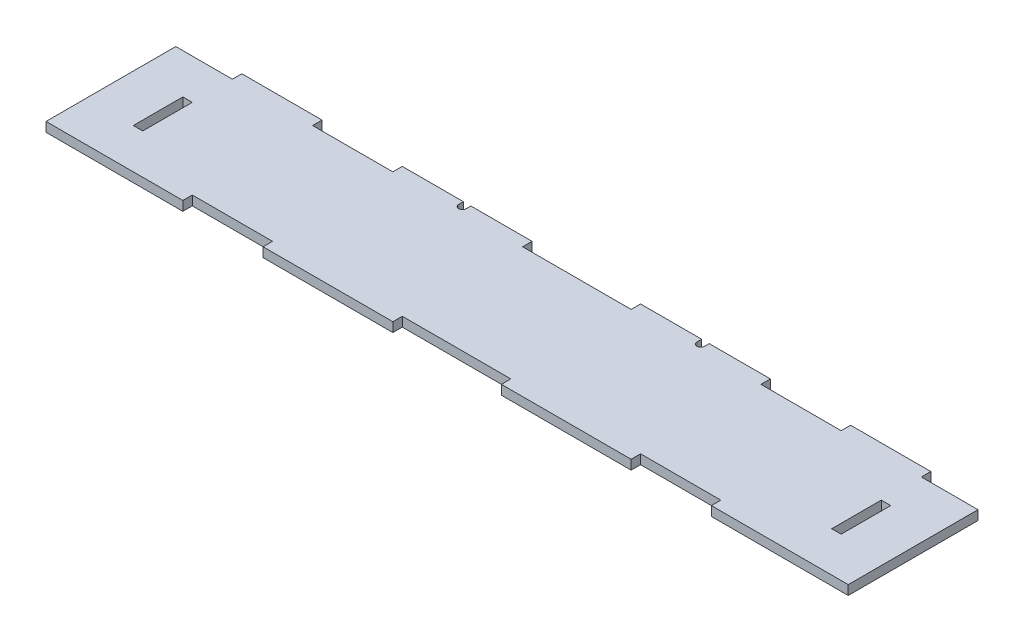
from build123d import *

# Parameters (mm, degrees)
SKETCH1_W           = 4
SKETCH1_H           = 21
BOSS_EXTRUDE1_DEPTH = 4
CUT_EXTRUDE1_REACH  = 174.587
SKETCH3_W           = 34
SKETCH3_H           = 4
SKETCH3_W_2         = 46
SKETCH3_W_3         = 24


with BuildPart() as part:
    # Sketch1 → Boss-Extrude1 (new body)
    with BuildSketch(Plane(origin=(0, 0, 0), x_dir=(1, 0, 0), z_dir=(0, 1, 0))):
        with BuildLine():
            Line((-170, -29.5), (170, -29.5))
            Line((170, -29.5), (170, 29.5))
            Line((170, 29.5), (112, 29.5))
            Line((112, 29.5), (112, 25.5))
            Line((112, 25.5), (78, 25.5))
            Line((78, 25.5), (78, 29.5))
            Line((78, 29.5), (52.1, 29.5))
            Line((52.1, 29.5), (52.1, 27.5))
            ThreePointArc((52.1, 27.5), (50.5, 25.9), (48.9, 27.5))
            Line((48.9, 27.5), (48.9, 29.5))
            Line((48.9, 29.5), (23, 29.5))
            Line((23, 29.5), (23, 25.5))
            Line((23, 25.5), (-23, 25.5))
            Line((-23, 25.5), (-23, 29.5))
            Line((-23, 29.5), (-48.9, 29.5))
            Line((-48.9, 29.5), (-48.9, 27.5))
            ThreePointArc((-48.9, 27.5), (-50.5, 25.9), (-52.1, 27.5))
            Line((-52.1, 27.5), (-52.1, 29.5))
            Line((-52.1, 29.5), (-78, 29.5))
            Line((-78, 29.5), (-78, 25.5))
            Line((-78, 25.5), (-112, 25.5))
            Line((-112, 25.5), (-112, 29.5))
            Line((-112, 29.5), (-170, 29.5))
            Line((-170, 29.5), (-170, -29.5))
        make_face()
        with Locations((-148, -2)):
            Rectangle(SKETCH1_W, SKETCH1_H, mode=Mode.SUBTRACT)
        with Locations((148, -2)):
            Rectangle(SKETCH1_W, SKETCH1_H, mode=Mode.SUBTRACT)
    extrude(amount=BOSS_EXTRUDE1_DEPTH)

    # Sketch3 → Cut-Extrude1 (cut, up to next)
    with BuildSketch(Plane.XZ, mode=Mode.PRIVATE) as cut_extrude1_sk1:
        with Locations((-95, 27.5)):
            Rectangle(SKETCH3_W, SKETCH3_H)
    cut_extrude1_tool1 = extrude(cut_extrude1_sk1.sketch, amount=-CUT_EXTRUDE1_REACH, mode=Mode.PRIVATE) & part.part
    # Sketch3 → Cut-Extrude1 (cut, up to next)
    with BuildSketch(Plane.XZ, mode=Mode.PRIVATE) as cut_extrude1_sk2:
        with Locations((0, 27.5)):
            Rectangle(SKETCH3_W_2, SKETCH3_H)
    cut_extrude1_tool2 = extrude(cut_extrude1_sk2.sketch, amount=-CUT_EXTRUDE1_REACH, mode=Mode.PRIVATE) & part.part
    # Sketch3 → Cut-Extrude1 (cut, up to next)
    with BuildSketch(Plane.XZ, mode=Mode.PRIVATE) as cut_extrude1_sk3:
        with Locations((95, 27.5)):
            Rectangle(SKETCH3_W, SKETCH3_H)
    cut_extrude1_tool3 = extrude(cut_extrude1_sk3.sketch, amount=-CUT_EXTRUDE1_REACH, mode=Mode.PRIVATE) & part.part
    # Sketch3 → Cut-Extrude1 (cut, up to next)
    with BuildSketch(Plane.XZ, mode=Mode.PRIVATE) as cut_extrude1_sk4:
        with Locations((-158, -27.5)):
            Rectangle(SKETCH3_W_3, SKETCH3_H)
    cut_extrude1_tool4 = extrude(cut_extrude1_sk4.sketch, amount=-CUT_EXTRUDE1_REACH, mode=Mode.PRIVATE) & part.part
    # Sketch3 → Cut-Extrude1 (cut, up to next)
    with BuildSketch(Plane.XZ, mode=Mode.PRIVATE) as cut_extrude1_sk5:
        with Locations((158, -27.5)):
            Rectangle(SKETCH3_W_3, SKETCH3_H)
    cut_extrude1_tool5 = extrude(cut_extrude1_sk5.sketch, amount=-CUT_EXTRUDE1_REACH, mode=Mode.PRIVATE) & part.part
    add(cut_extrude1_tool1.solids().sort_by_distance((-95, 0, 27.5))[0], mode=Mode.SUBTRACT)
    add(cut_extrude1_tool2.solids().sort_by_distance((0, 0, 27.5))[0], mode=Mode.SUBTRACT)
    add(cut_extrude1_tool3.solids().sort_by_distance((95, 0, 27.5))[0], mode=Mode.SUBTRACT)
    add(cut_extrude1_tool4.solids().sort_by_distance((-158, 0, -27.5))[0], mode=Mode.SUBTRACT)
    add(cut_extrude1_tool5.solids().sort_by_distance((158, 0, -27.5))[0], mode=Mode.SUBTRACT)


solid = part.part
